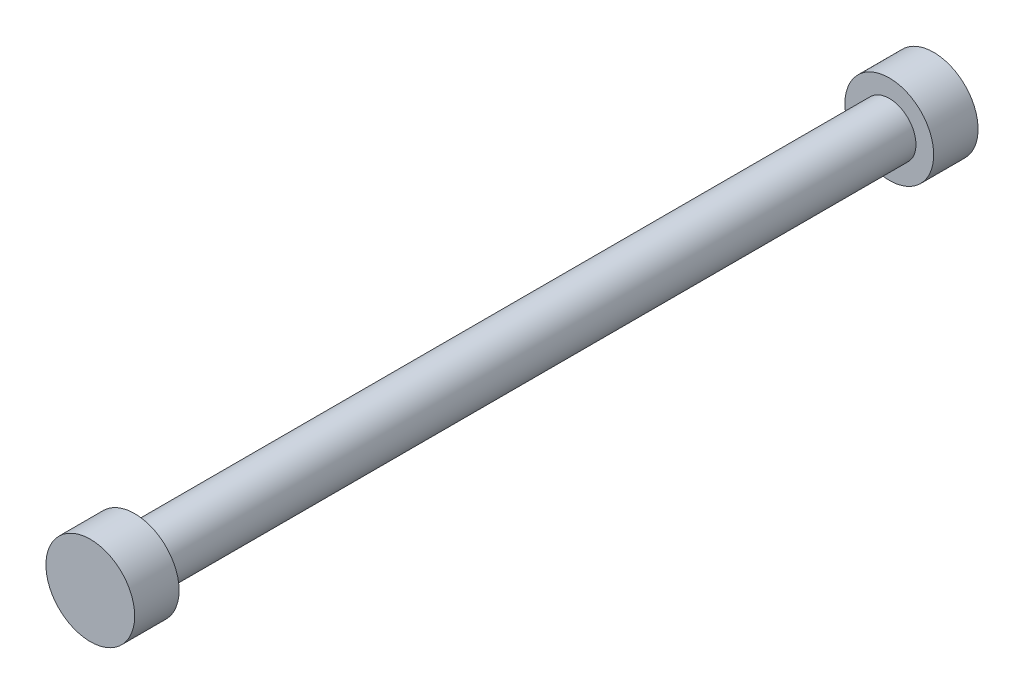
from build123d import *

# Parameters (mm, degrees)
IZIM1_R                     = 3
Y_KSEKLIK_EKSTR_ZYON1_DEPTH = 85
IZIM2_R                     = 5
Y_KSEKLIK_EKSTR_ZYON2_DEPTH = 5
Y_KSEKLIK_EKSTR_ZYON3_START = 5
IZIM3_R                     = 5
Y_KSEKLIK_EKSTR_ZYON3_DEPTH = 5


with BuildPart() as part:
    # Çizim1 → Yükseklik-Ekstrüzyon1 (new body)
    with BuildSketch(Plane.XY):
        with Locations((-6.071139899, 4.83018363)):
            Circle(IZIM1_R)
    extrude(amount=Y_KSEKLIK_EKSTR_ZYON1_DEPTH)

    # Çizim2 → Yükseklik-Ekstrüzyon2 (add)
    with BuildSketch(Plane(origin=(0, 0, 0), x_dir=(-1, 0, 0), z_dir=(0, 0, -1))):
        with Locations((6.071139899, 4.83018363)):
            Circle(IZIM2_R)
    extrude(amount=Y_KSEKLIK_EKSTR_ZYON2_DEPTH)

    # Çizim3 → Yükseklik-Ekstrüzyon3 (add)
    with BuildSketch(Plane.XY.offset(85).offset(Y_KSEKLIK_EKSTR_ZYON3_START)):
        with Locations(Location((-6.071139899, 4.83018363, 0), (0, 0, 180))):
            Circle(IZIM3_R)
    extrude(amount=-Y_KSEKLIK_EKSTR_ZYON3_DEPTH)


solid = part.part
